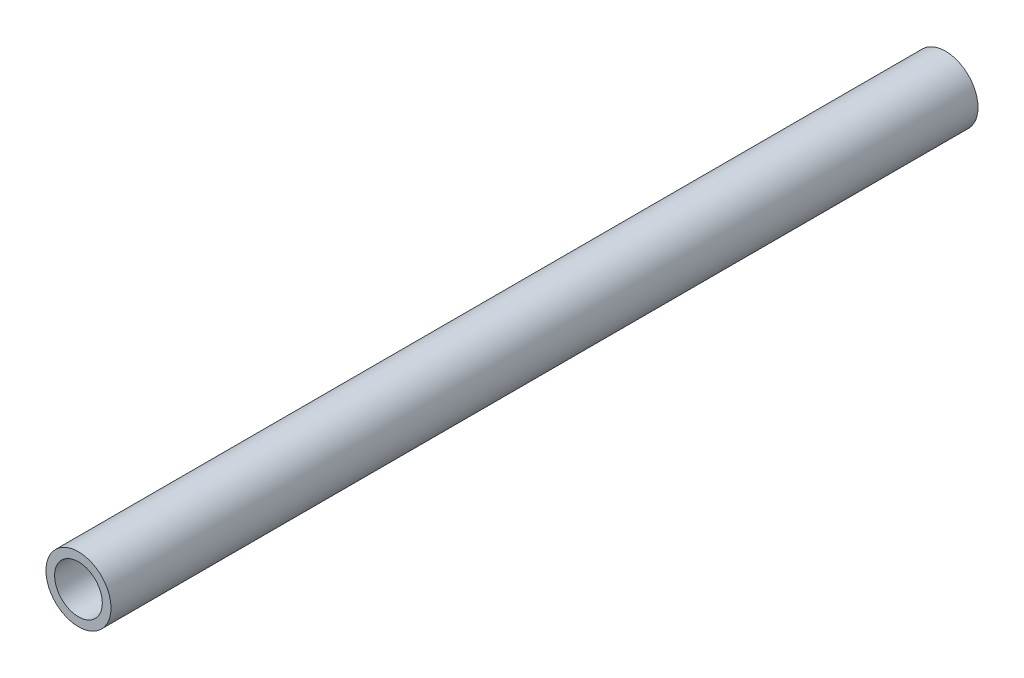
from build123d import *

# Parameters (mm, degrees)
SKETCH1_R           = 3.75
SKETCH1_R_2         = 2.75
BOSS_EXTRUDE1_DEPTH = 100


with BuildPart() as part:
    # Sketch1 → Boss-Extrude1 (new body)
    with BuildSketch(Plane.XY):
        with Locations((-32.899281496, 249.847725303)):
            Circle(SKETCH1_R)
        with Locations((-32.899281496, 249.847725303)):
            Circle(SKETCH1_R_2, mode=Mode.SUBTRACT)
    extrude(amount=BOSS_EXTRUDE1_DEPTH)


solid = part.part
